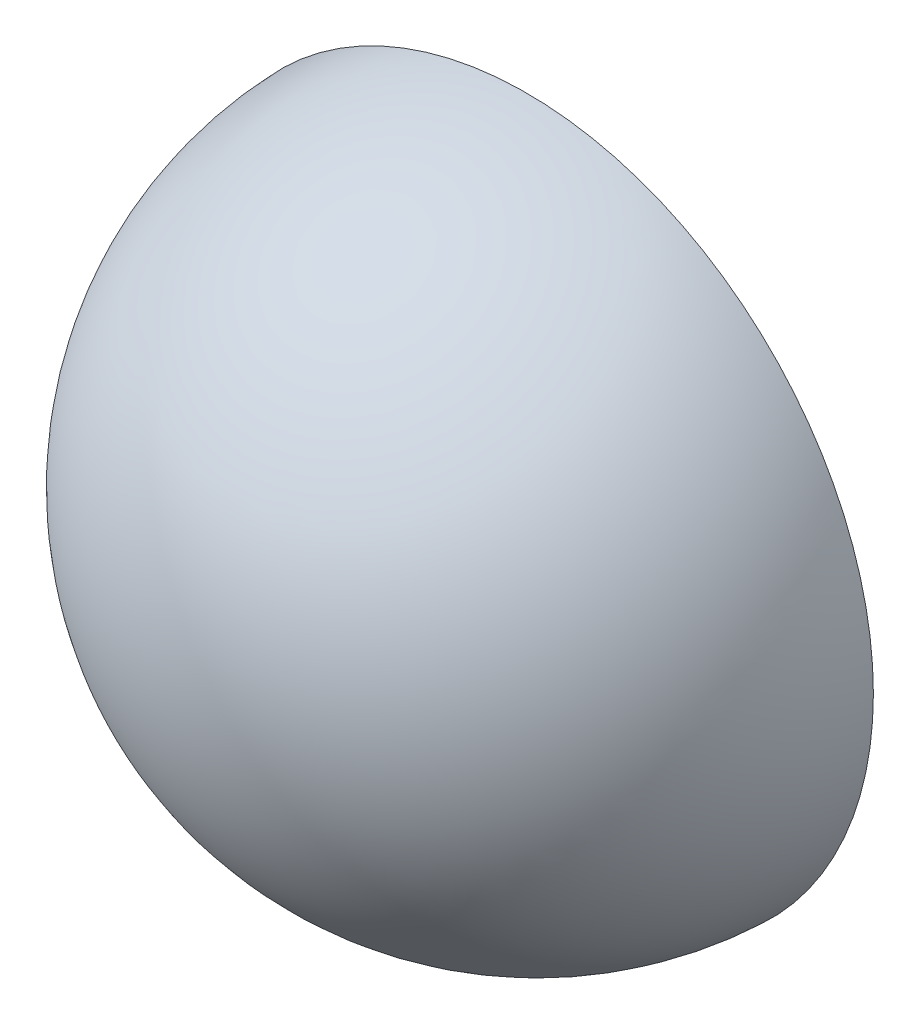
from build123d import *


with BuildPart() as part:
    # 草图2 → 旋转1 (revolve)
    with BuildSketch(Plane(origin=(0, 0, 0), x_dir=(1, 0, 0), z_dir=(0, 1, 0))):
        with BuildLine():
            Line((0, -71.414980817), (0, -71.930131884))
            ThreePointArc((0, -71.930131884), (7.898911537, -68.727316973), (11.336636736, -60.927773891))
            Line((11.336636736, -60.927773891), (10.487206926, -60.927773891))
            ThreePointArc((10.487206926, -60.927773891), (7.415575133, -68.343349024), (0, -71.414980817))
        make_face()
    revolve(axis=Axis((0, 0, 0), (0, 0, -1)))


solid = part.part
